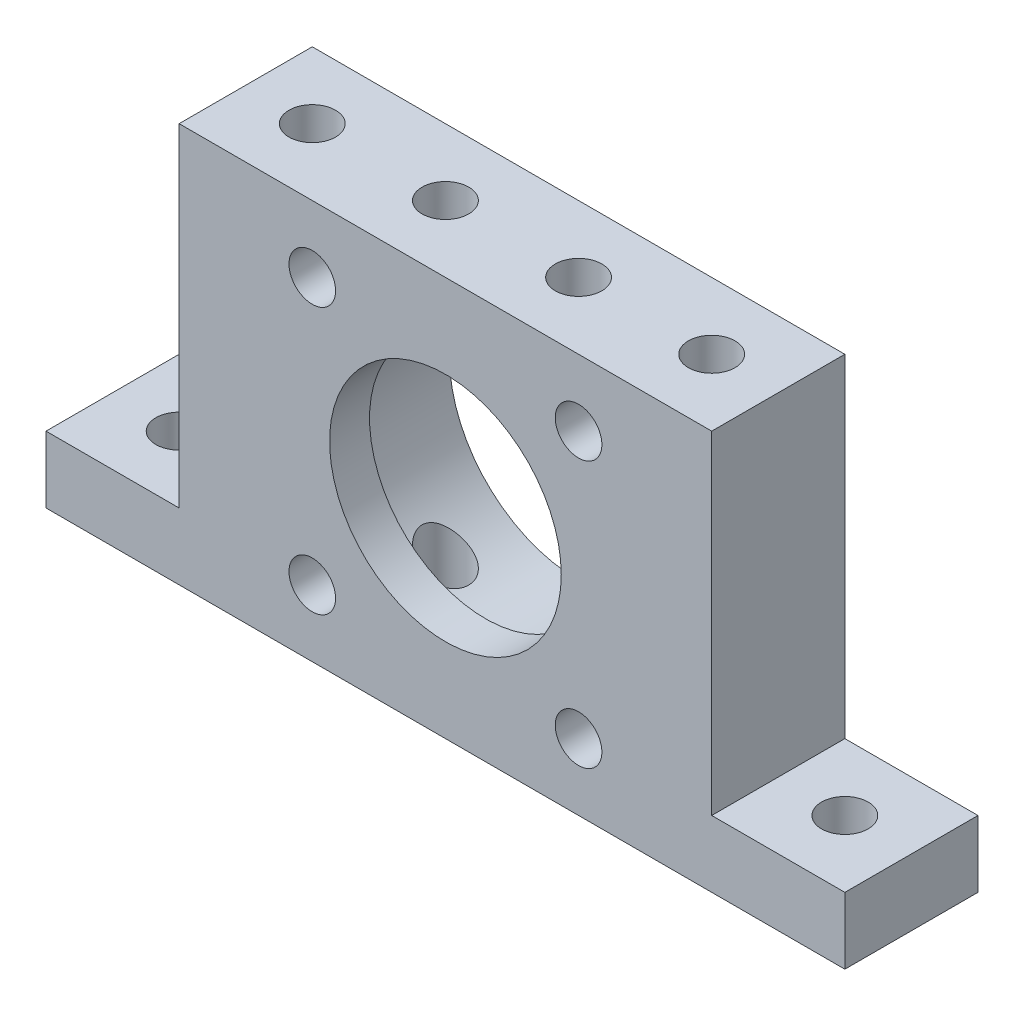
from build123d import *

# Parameters (mm, degrees)
ESQUISSE1_R             = 9.7
ESQUISSE1_R_2           = 1.75
BOSS_EXTRU_1_DEPTH      = 10
BOSS_EXTRU_2_START      = -3
ESQUISSE2_R             = 9.7
ESQUISSE2_R_2           = 8.7
BOSS_EXTRU_2_DEPTH      = 3
ESQUISSE3_R             = 1.75
ENL_V_MAT_EXTRU_1_DEPTH = 44.588989435


with BuildPart() as part:
    # Esquisse1 → Boss.-Extru.1 (new body)
    with BuildSketch(Plane.XY):
        Polygon((-20, -10), (-20, 15), (20, 15), (20, -10), (30, -10), (30, -15), (-30, -15), (-30, -10), align=None)
        Circle(ESQUISSE1_R, mode=Mode.SUBTRACT)
        with Locations((10, 10)):
            Circle(ESQUISSE1_R_2, mode=Mode.SUBTRACT)
        with Locations((-10, 10)):
            Circle(ESQUISSE1_R_2, mode=Mode.SUBTRACT)
        with Locations((-10, -10)):
            Circle(ESQUISSE1_R_2, mode=Mode.SUBTRACT)
        with Locations((10, -10)):
            Circle(ESQUISSE1_R_2, mode=Mode.SUBTRACT)
    extrude(amount=BOSS_EXTRU_1_DEPTH)

    # Esquisse2 → Boss.-Extru.2 (add)
    with BuildSketch(Plane.XY.offset(10).offset(BOSS_EXTRU_2_START)):
        Circle(ESQUISSE2_R)
        Circle(ESQUISSE2_R_2, mode=Mode.SUBTRACT)
    extrude(amount=BOSS_EXTRU_2_DEPTH)

    # Esquisse3 → Enlèv. mat.-Extru.1 (cut, through all)
    with BuildSketch(Plane.XZ.offset(15)):
        with Locations(Location((-25, 5, 0), (0, 0, 270))):
            Circle(ESQUISSE3_R)
        with Locations(Location((-15, 5, 0), (0, 0, 270))):
            Circle(ESQUISSE3_R)
        with Locations(Location((-5, 5, 0), (0, 0, 270))):
            Circle(ESQUISSE3_R)
        with Locations(Location((5, 5, 0), (0, 0, 270))):
            Circle(ESQUISSE3_R)
        with Locations(Location((15, 5, 0), (0, 0, 270))):
            Circle(ESQUISSE3_R)
        with Locations(Location((25, 5, 0), (0, 0, 270))):
            Circle(ESQUISSE3_R)
    extrude(amount=-ENL_V_MAT_EXTRU_1_DEPTH, mode=Mode.SUBTRACT)


solid = part.part
